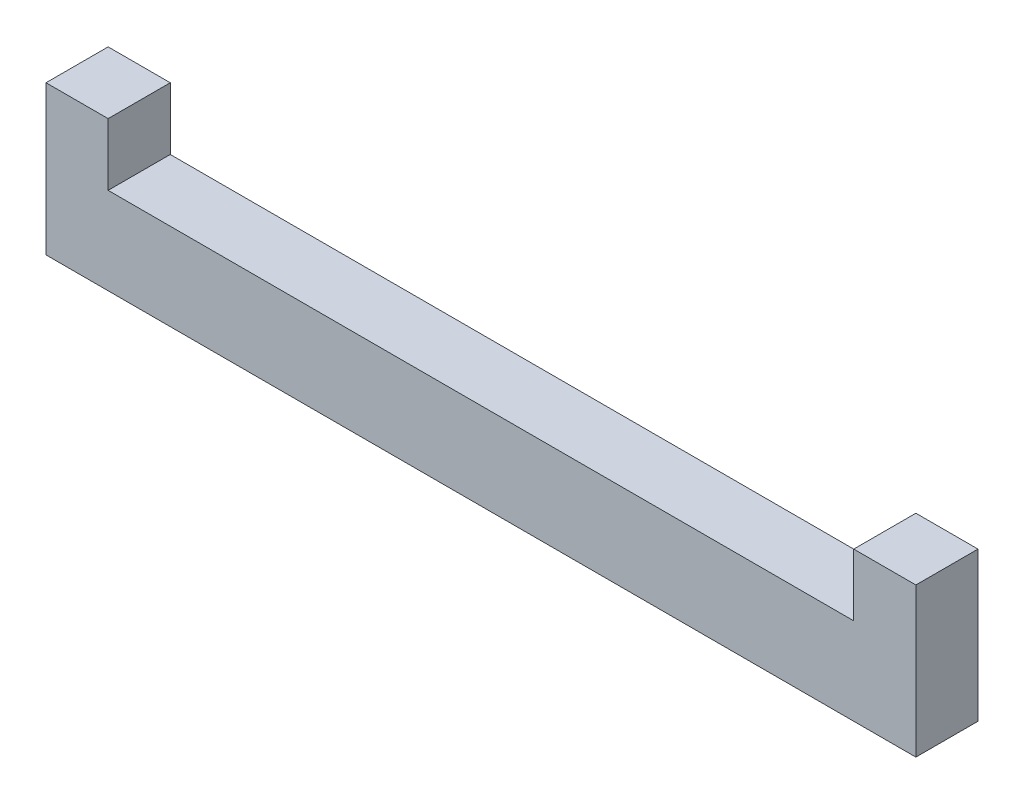
from build123d import *

# Parameters (mm, degrees)
BOSS_EXTRU_1_DEPTH = 5


with BuildPart() as part:
    # Esquisse1 → Boss.-Extru.1 (new body)
    with BuildSketch(Plane.XY):
        Polygon((-133.983627477, 222.421111622), (-128.983627477, 222.421111622), (-128.983627477, 217.421111622), (-68.983627477, 217.421111622), (-68.983627477, 222.421111622), (-63.983627477, 222.421111622), (-63.983627477, 210.421111622), (-133.983627477, 210.421111622), align=None)
    extrude(amount=-BOSS_EXTRU_1_DEPTH)


solid = part.part
